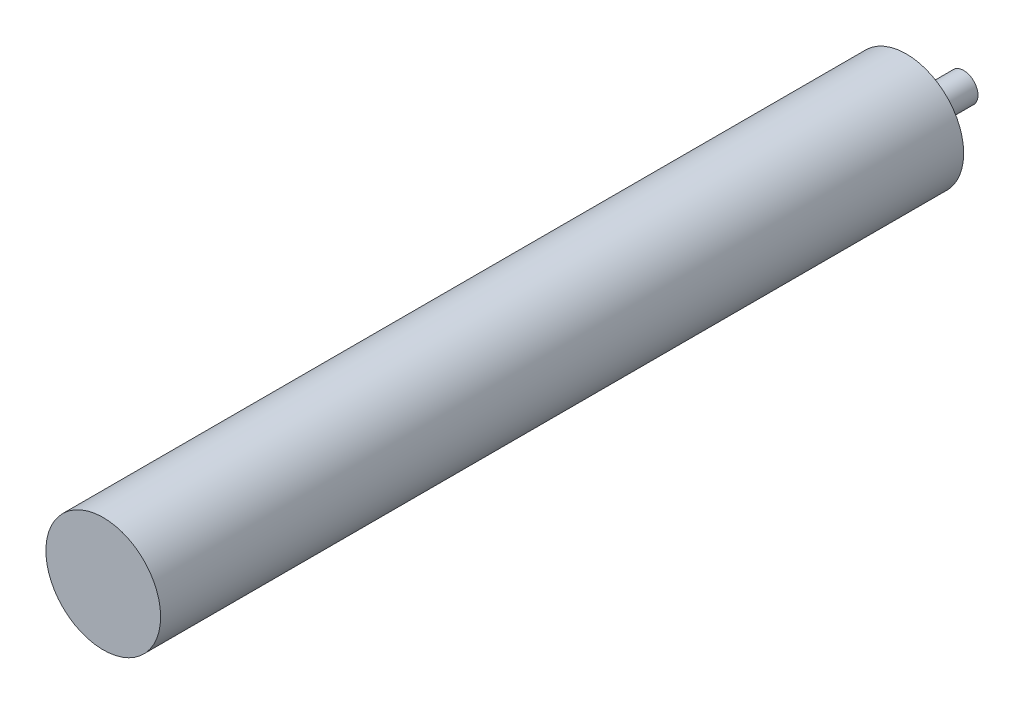
from build123d import *

# Parameters (mm, degrees)
IZIM2_R                     = 0.5
Y_KSEKLIK_EKSTR_ZYON1_DEPTH = 2
IZIM3_R                     = 2
Y_KSEKLIK_EKSTR_ZYON2_DEPTH = 28


with BuildPart() as part:
    # Çizim2 → Yükseklik-Ekstrüzyon1 (new body)
    with BuildSketch(Plane.XY):
        Circle(IZIM2_R)
    extrude(amount=Y_KSEKLIK_EKSTR_ZYON1_DEPTH)

    # Çizim3 → Yükseklik-Ekstrüzyon2 (add)
    with BuildSketch(Plane.XY.offset(2)):
        Circle(IZIM3_R)
    extrude(amount=Y_KSEKLIK_EKSTR_ZYON2_DEPTH)


solid = part.part
